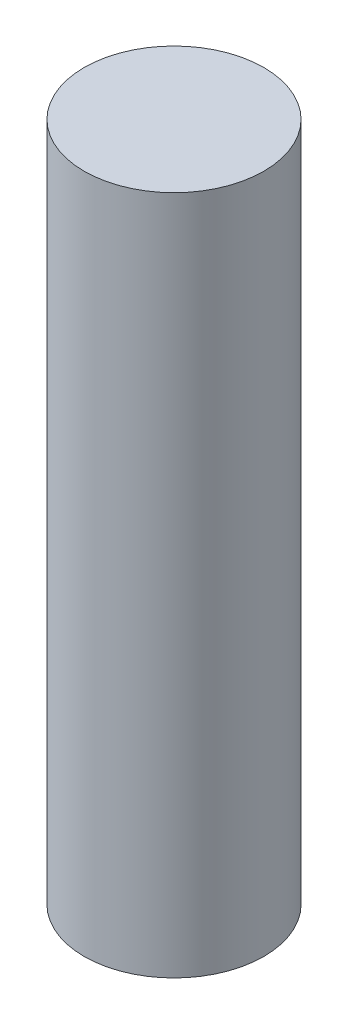
from build123d import *

# Parameters (mm, degrees)
SKETCH1_R           = 12.55
BOSS_EXTRUDE1_DEPTH = 95


with BuildPart() as part:
    # Sketch1 → Boss-Extrude1 (new body)
    with BuildSketch(Plane(origin=(0, 0, 0), x_dir=(1, 0, 0), z_dir=(0, 1, 0))):
        with Locations(Location((0, 0, 0), (0, 0, 270))):
            Circle(SKETCH1_R)
    extrude(amount=BOSS_EXTRUDE1_DEPTH)


solid = part.part
